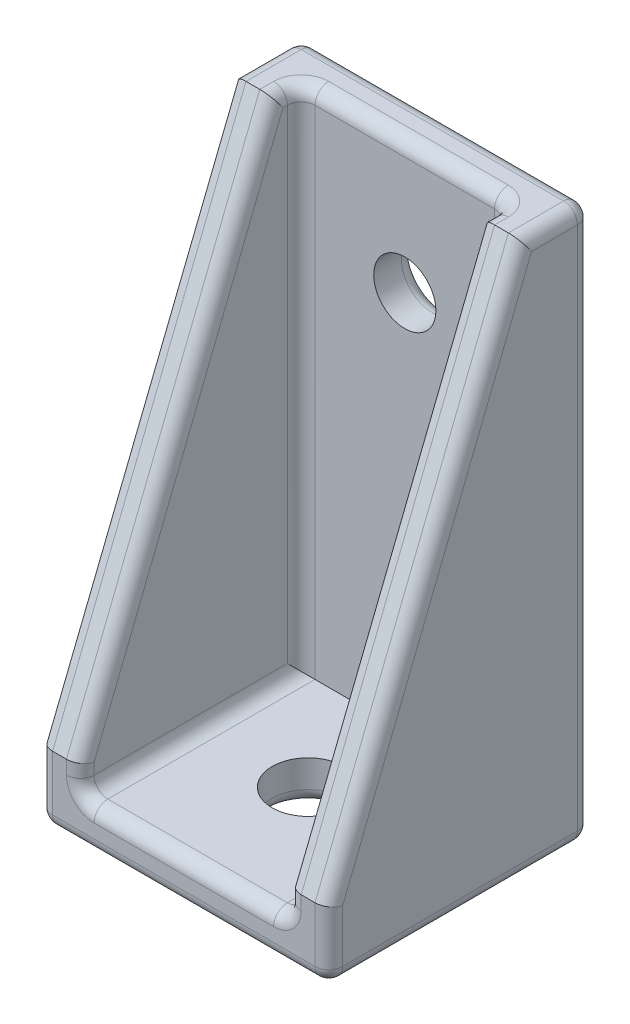
from build123d import *

# Parameters (mm, degrees)
BOSS_EXTRUDE1_DEPTH = 3
BOSS_EXTRUDE2_DEPTH = 15
BOSS_EXTRUDE3_DEPTH = 3
SKETCH5_R           = 2.25
CUT_EXTRUDE1_DEPTH  = 3
SKETCH6_R           = 2.6
CUT_EXTRUDE2_DEPTH  = 3
FILLET1_R           = 1


with BuildPart() as part:
    # Sketch2 → Boss-Extrude1 (new body)
    with BuildSketch(Plane(origin=(0, 0, 0), x_dir=(0, 0, -1), z_dir=(1, 0, 0))):
        Polygon((0, 0), (0, 40), (-5, 40), (-19, 5), (-19, 0), align=None)
    extrude(amount=BOSS_EXTRUDE1_DEPTH)

    # Sketch3 → Boss-Extrude2 (add)
    with BuildSketch(Plane(origin=(3, 0, 0), x_dir=(0, 0, -1), z_dir=(1, 0, 0))):
        Polygon((-19, 0), (-19, 3), (-3, 3), (-3, 40), (0, 40), (0, 0), align=None)
    extrude(amount=BOSS_EXTRUDE2_DEPTH)

    # Sketch4 → Boss-Extrude3 (add)
    with BuildSketch(Plane(origin=(18, 0, 0), x_dir=(0, 0, -1), z_dir=(1, 0, 0))):
        Polygon((-19, 0), (0, 0), (0, 40), (-5, 40), (-19, 5), align=None)
    extrude(amount=BOSS_EXTRUDE3_DEPTH)

    # Sketch5 → Cut-Extrude1 (cut)
    with BuildSketch(Plane(origin=(0, 0, 0), x_dir=(-1, 0, 0), z_dir=(0, 0, -1))):
        with Locations((-10.5, 30.5)):
            Circle(SKETCH5_R)
    extrude(amount=-CUT_EXTRUDE1_DEPTH, mode=Mode.SUBTRACT)

    # Sketch6 → Cut-Extrude2 (cut)
    with BuildSketch(Plane.XZ):
        with Locations(Location((10.5, 10, 0), (0, 0, 270))):
            Circle(SKETCH6_R)
    extrude(amount=-CUT_EXTRUDE2_DEPTH, mode=Mode.SUBTRACT)

    # Fillet1
    fillet1_edges = [part.edges().sort_by_distance(p)[0] for p in [
        (3, 22.5, 12),
        (3, 4, 19),
        (3, 40, 4),
        (3, 21.5, 3),
        (10.5, 40, 3),
        (3, 3, 11),
        (10.5, 3, 19),
        (18, 21.5, 3),
        (18, 3, 11),
        (18, 40, 4),
        (18, 22.5, 12),
        (18, 4, 19),
        (21, 20, 0),
        (21, 40, 2.5),
        (21, 22.5, 12),
        (21, 2.5, 19),
        (21, 0, 9.5),
        (0, 2.5, 19),
        (12.75, 30.5, 0),
        (0, 22.5, 12),
        (10.5, 0, 12.6),
        (0, 40, 2.5),
        (0, 20, 0),
        (0, 0, 9.5),
        (10.5, 0, 19),
        (10.5, 40, 0),
        (10.5, 0, 0),
    ]]
    fillet(fillet1_edges, radius=FILLET1_R)


solid = part.part
